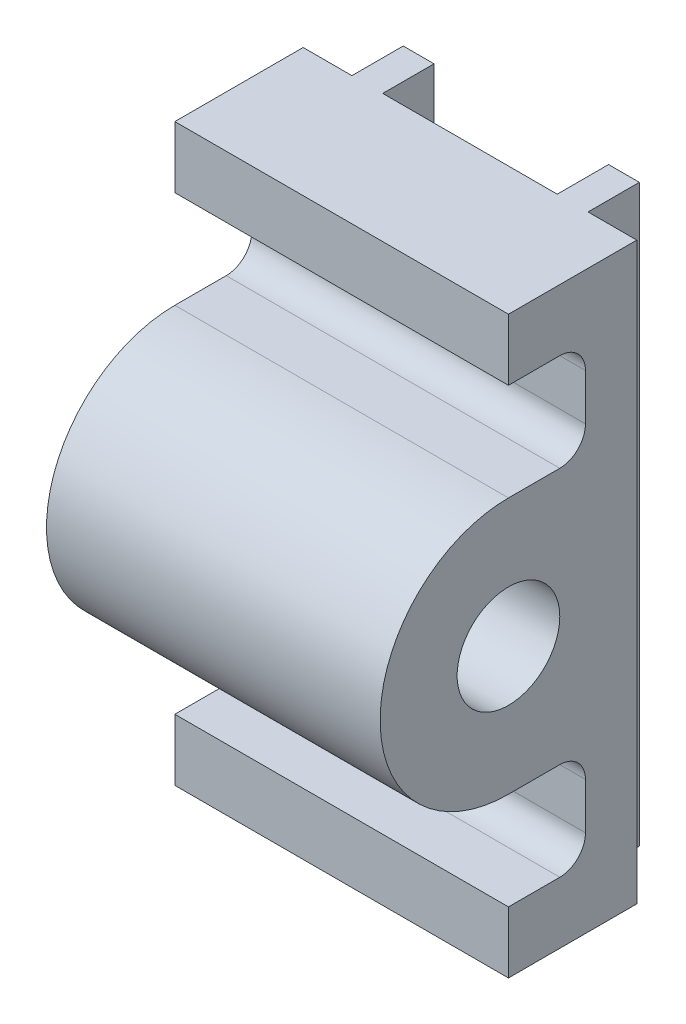
from build123d import *

# Parameters (mm, degrees)
SKETCH1_R           = 10
BOSS_EXTRUDE1_DEPTH = 32.5
SKETCH2_W           = 6
SKETCH2_H           = 112
BOSS_EXTRUDE2_DEPTH = 10


with BuildPart() as part:
    # Sketch1 → Boss-Extrude1 (new, symmetric)
    with BuildSketch(Plane.YZ):
        with BuildLine():
            Line((-25, 0), (-25, -10))
            ThreePointArc((-25, -10), (-26.464466094, -13.535533906), (-30, -15))
            Line((-30, -15), (-39, -15))
            ThreePointArc((-39, -15), (-42.535533906, -13.535533906), (-44, -10))
            Line((-44, -10), (-44, 0))
            Line((-44, 0), (-56, 0))
            Line((-56, 0), (-56, -25))
            Line((-56, -25), (56, -25))
            Line((56, -25), (56, 0))
            Line((56, 0), (44, 0))
            Line((44, 0), (44, -10))
            ThreePointArc((44, -10), (42.535533906, -13.535533906), (39, -15))
            Line((39, -15), (30, -15))
            ThreePointArc((30, -15), (26.464466094, -13.535533906), (25, -10))
            Line((25, -10), (25, 0))
            ThreePointArc((25, 0), (0, 25), (-25, 0))
        make_face()
        with Locations(Location((0, 0, 0), (0, 0, 270))):
            Circle(SKETCH1_R, mode=Mode.SUBTRACT)
    extrude(amount=BOSS_EXTRUDE1_DEPTH, both=True)

    # Sketch2 → Boss-Extrude2 (add)
    with BuildSketch(Plane(origin=(0, 0, -25), x_dir=(1, 0, 0), z_dir=(0, 0, -1))):
        with Locations((-20, 0)):
            Rectangle(SKETCH2_W, SKETCH2_H)
        with Locations((20, 0)):
            Rectangle(SKETCH2_W, SKETCH2_H)
    extrude(amount=BOSS_EXTRUDE2_DEPTH)


solid = part.part
